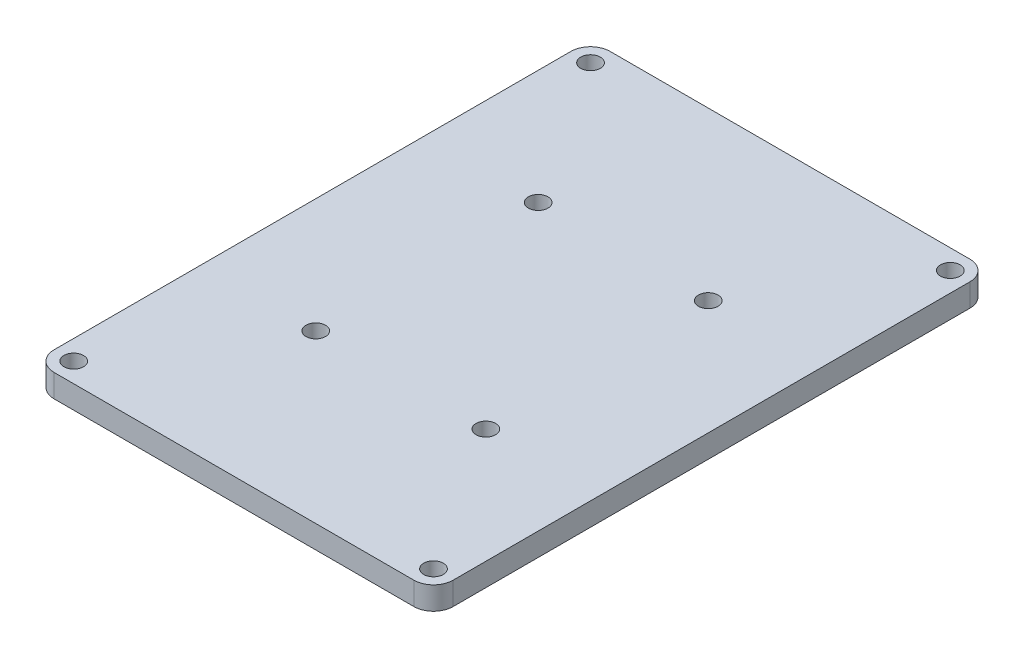
from build123d import *

# Parameters (mm, degrees)
SKETCH1_W           = 61
SKETCH1_H           = 85
BOSS_EXTRUDE1_DEPTH = 3.5
SKETCH2_R           = 1.5
CUT_EXTRUDE1_DEPTH  = 3.5
SKETCH3_R           = 1.5
CUT_EXTRUDE2_DEPTH  = 3.5
FILLET1_R           = 3


with BuildPart() as part:
    # Sketch1 → Boss-Extrude1 (new body)
    with BuildSketch(Plane(origin=(0, 0, 0), x_dir=(1, 0, 0), z_dir=(0, 1, 0))):
        Rectangle(SKETCH1_W, SKETCH1_H)
    extrude(amount=BOSS_EXTRUDE1_DEPTH)

    # Sketch2 → Cut-Extrude1 (cut)
    with BuildSketch(Plane(origin=(0, 3.5, 0), x_dir=(1, 0, 0), z_dir=(0, 1, 0))):
        with Locations(Location((-27.5, 39.5, 0), (0, 0, 270))):
            Circle(SKETCH2_R)
        with Locations(Location((27.5, 39.5, 0), (0, 0, 270))):
            Circle(SKETCH2_R)
        with Locations(Location((-27.5, -39.5, 0), (0, 0, 270))):
            Circle(SKETCH2_R)
        with Locations(Location((27.5, -39.5, 0), (0, 0, 270))):
            Circle(SKETCH2_R)
    extrude(amount=-CUT_EXTRUDE1_DEPTH, mode=Mode.SUBTRACT)

    # Sketch3 → Cut-Extrude2 (cut)
    with BuildSketch(Plane(origin=(0, 3.5, 0), x_dir=(1, 0, 0), z_dir=(0, 1, 0))):
        with Locations(Location((-13, 17, 0), (0, 0, 270))):
            Circle(SKETCH3_R)
        with Locations(Location((13, -17, 0), (0, 0, 270))):
            Circle(SKETCH3_R)
        with Locations(Location((13, 17, 0), (0, 0, 270))):
            Circle(SKETCH3_R)
        with Locations(Location((-13, -17, 0), (0, 0, 270))):
            Circle(SKETCH3_R)
    extrude(amount=-CUT_EXTRUDE2_DEPTH, mode=Mode.SUBTRACT)

    # Fillet1
    fillet1_edges = [part.edges().sort_by_distance(p)[0] for p in [
        (30.5, 1.75, 42.5),
        (-30.5, 1.75, 42.5),
        (-30.5, 1.75, -42.5),
        (30.5, 1.75, -42.5),
    ]]
    fillet(fillet1_edges, radius=FILLET1_R)


solid = part.part
